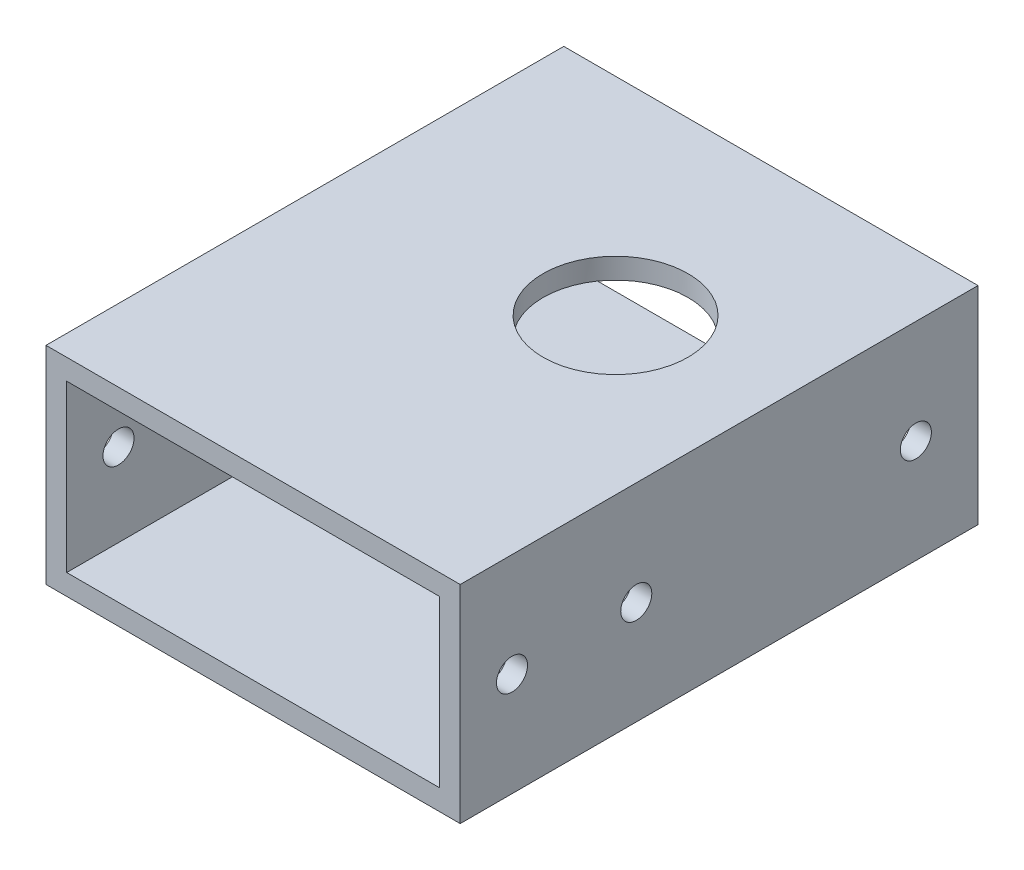
from build123d import *

# Parameters (mm, degrees)
SKETCH_1_W          = 40
SKETCH_1_H          = 20
SKETCH_1_W_2        = 36
SKETCH_1_H_2        = 16
EXTRUDE_1_DEPTH     = 50
SKETCH_2_R          = 7
CUT_EXTRUDE_1_DEPTH = 20
SKETCH_3_R          = 1.5
CUT_EXTRUDE_2_DEPTH = 50


with BuildPart() as part:
    # 草图1 → 凸台-拉伸1 (new body)
    with BuildSketch(Plane.XY):
        Rectangle(SKETCH_1_W, SKETCH_1_H)
        Rectangle(SKETCH_1_W_2, SKETCH_1_H_2, mode=Mode.SUBTRACT)
    extrude(amount=EXTRUDE_1_DEPTH)

    # 草图2 → 切除-拉伸1 (cut)
    with BuildSketch(Plane(origin=(0, 10, 0), x_dir=(1, 0, 0), z_dir=(0, 1, 0))):
        with Locations(Location((5, -20, 0), (0, 0, 270))):
            Circle(SKETCH_2_R)
    extrude(amount=-CUT_EXTRUDE_1_DEPTH, mode=Mode.SUBTRACT)

    # 草图3 → 切除-拉伸2 (cut)
    with BuildSketch(Plane(origin=(20, 0, 0), x_dir=(0, 0, -1), z_dir=(1, 0, 0))):
        with Locations(Location((-6, 0, 0), (0, 0, 90))):
            Circle(SKETCH_3_R)
        with Locations(Location((-33, 0, 0), (0, 0, 90))):
            Circle(SKETCH_3_R)
        with Locations(Location((-45, 0, 0), (0, 0, 90))):
            Circle(SKETCH_3_R)
    extrude(amount=-CUT_EXTRUDE_2_DEPTH, mode=Mode.SUBTRACT)


solid = part.part
